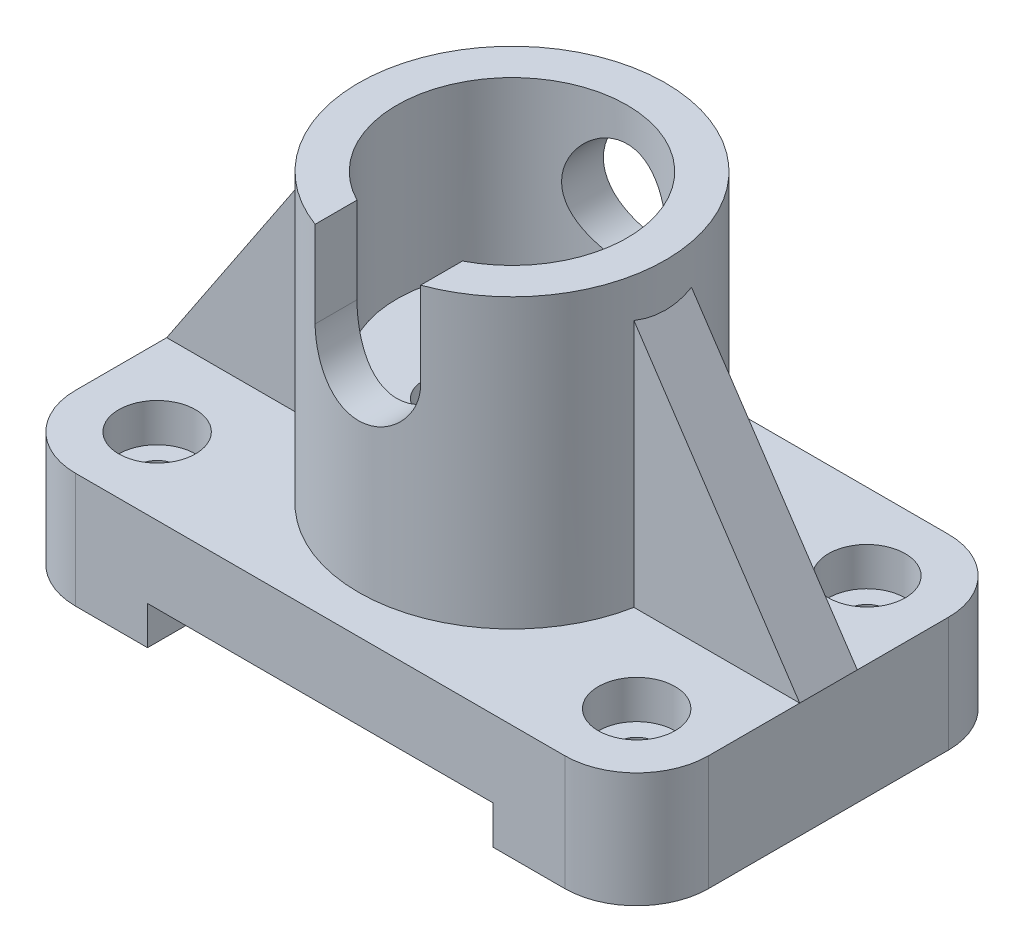
from build123d import *

# Parameters (mm, degrees)
SKETCH_1_R          = 4
EXTRUDE_1_DEPTH     = 24
SKETCH_2_W          = 72
SKETCH_2_H          = 16
CUT_EXTRUDE_1_DEPTH = 107.451867057
SKETCH_3_R          = 8
CUT_EXTRUDE_2_DEPTH = 8
SKETCH_5_R          = 32
EXTRUDE_2_DEPTH     = 60
SKETCH_6_R          = 24
CUT_EXTRUDE_3_DEPTH = 35
CUT_EXTRUDE_4_DEPTH = 15
SKETCH_8_R          = 6.5
CUT_EXTRUDE_5_DEPTH = 86
SKETCH_9_R          = 11
CUT_EXTRUDE_6_DEPTH = 86
SKETCH_10_W         = 22
SKETCH_10_H         = 21.722562354
CUT_EXTRUDE_7_DEPTH = 38
RIB_8_REACH         = 116.07
SKETCH_12_WALL_W    = 293.316673134
SKETCH_12_WALL_H    = 12


with BuildPart() as part:
    # 草图1 → 凸台-拉伸1 (new body)
    with BuildSketch(Plane(origin=(0, 0, 0), x_dir=(1, 0, 0), z_dir=(0, 1, 0))):
        with BuildLine():
            Line((51, 40), (-51, 40))
            ThreePointArc((-51, 40), (-61.606601718, 35.606601718), (-66, 25))
            Line((-66, 25), (-66, -25))
            ThreePointArc((-66, -25), (-61.606601718, -35.606601718), (-51, -40))
            Line((-51, -40), (51, -40))
            ThreePointArc((51, -40), (61.606601718, -35.606601718), (66, -25))
            Line((66, -25), (66, 25))
            ThreePointArc((66, 25), (61.606601718, 35.606601718), (51, 40))
        make_face()
        with Locations(Location((-50, 24, 0), (0, 0, 270))):
            Circle(SKETCH_1_R, mode=Mode.SUBTRACT)
        with Locations(Location((50, 24, 0), (0, 0, 270))):
            Circle(SKETCH_1_R, mode=Mode.SUBTRACT)
        with Locations(Location((50, -24, 0), (0, 0, 270))):
            Circle(SKETCH_1_R, mode=Mode.SUBTRACT)
        with Locations(Location((-50, -24, 0), (0, 0, 270))):
            Circle(SKETCH_1_R, mode=Mode.SUBTRACT)
    extrude(amount=EXTRUDE_1_DEPTH)

    # 草图2 → 切除-拉伸1 (cut, through all)
    with BuildSketch(Plane.XY.offset(40)):
        Rectangle(SKETCH_2_W, SKETCH_2_H)
    extrude(amount=-CUT_EXTRUDE_1_DEPTH, mode=Mode.SUBTRACT)

    # 草图3 → 切除-拉伸2 (cut)
    with BuildSketch(Plane(origin=(0, 24, 0), x_dir=(1, 0, 0), z_dir=(0, 1, 0))):
        with Locations(Location((-50, 24, 0), (0, 0, 270))):
            Circle(SKETCH_3_R)
        with Locations(Location((50, 24, 0), (0, 0, 270))):
            Circle(SKETCH_3_R)
        with Locations(Location((50, -24, 0), (0, 0, 270))):
            Circle(SKETCH_3_R)
        with Locations(Location((-50, -24, 0), (0, 0, 270))):
            Circle(SKETCH_3_R)
    extrude(amount=-CUT_EXTRUDE_2_DEPTH, mode=Mode.SUBTRACT)

    # 草图5 → 凸台-拉伸2 (add)
    with BuildSketch(Plane(origin=(0, 24, 0), x_dir=(1, 0, 0), z_dir=(0, 1, 0))):
        with Locations(Location((0, 0, 0), (0, 0, 90))):
            Circle(SKETCH_5_R)
    extrude(amount=EXTRUDE_2_DEPTH)

    # 草图6 → 切除-拉伸3 (cut)
    with BuildSketch(Plane(origin=(0, 84, 0), x_dir=(1, 0, 0), z_dir=(0, 1, 0))):
        with Locations(Location((0, 0, 0), (0, 0, 270))):
            Circle(SKETCH_6_R)
    extrude(amount=-CUT_EXTRUDE_3_DEPTH, mode=Mode.SUBTRACT)

    # 草图7 → 切除-拉伸4 (cut)
    with BuildSketch(Plane(origin=(0, 49, 0), x_dir=(1, 0, 0), z_dir=(0, 1, 0))):
        Polygon((6.5, -12), (-6.5, -12), (-6.5, 0), (-13, 0), (-13, 10), (13, 10), (13, 0), (6.5, 0), align=None)
    extrude(amount=-CUT_EXTRUDE_4_DEPTH, mode=Mode.SUBTRACT)

    # 草图8 → 切除-拉伸5 (cut)
    with BuildSketch(Plane(origin=(0, 49, 0), x_dir=(1, 0, 0), z_dir=(0, 1, 0))):
        with Locations(Location((0, -12, 0), (0, 0, 180))):
            Circle(SKETCH_8_R)
    extrude(amount=-CUT_EXTRUDE_5_DEPTH, mode=Mode.SUBTRACT)

    # 草图9 → 切除-拉伸6 (cut)
    with BuildSketch(Plane.XY.offset(40)):
        with Locations((0, 66)):
            Circle(SKETCH_9_R)
    extrude(amount=-CUT_EXTRUDE_6_DEPTH, mode=Mode.SUBTRACT)

    # 草图10 → 切除-拉伸7 (cut)
    with BuildSketch(Plane.XY.offset(40)):
        with Locations((0, 76.861281177)):
            Rectangle(SKETCH_10_W, SKETCH_10_H)
    extrude(amount=-CUT_EXTRUDE_7_DEPTH, mode=Mode.SUBTRACT)

    # 草图12 wall → 筋8 (add, up to next)
    with BuildSketch(Plane(origin=(-48.467514941, 50.275944325, 0), x_dir=(0.555033040636, 0.831828301876, 0), z_dir=(-0.831828301876, 0.555033040636, 0)), mode=Mode.PRIVATE) as rib_8_sk1:
        Rectangle(SKETCH_12_WALL_W, SKETCH_12_WALL_H)
    rib_8_tool1 = extrude(rib_8_sk1.sketch, amount=-RIB_8_REACH, mode=Mode.PRIVATE) - part.part
    rib_8 = rib_8_tool1.solids().sort_by_distance((-48.467514941, 50.275944325, 0))[0]
    add(rib_8)

    # 镜向2: 筋8 across plane
    add(rib_8.mirror(Plane(origin=(0, 0, 0), x_dir=(0, 0, 1), z_dir=(1, 0, 0))))


solid = part.part
